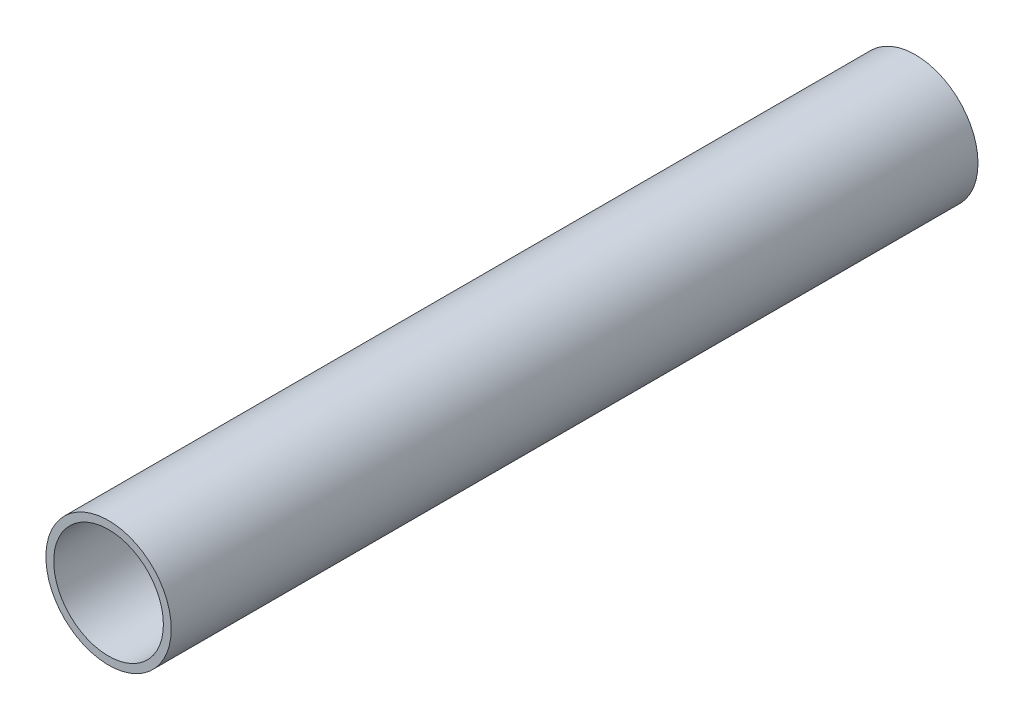
from build123d import *

# Parameters (mm, degrees)
SKETCH1_R           = 8
SKETCH1_R_2         = 7
BOSS_EXTRUDE1_DEPTH = 103


with BuildPart() as part:
    # Sketch1 → Boss-Extrude1 (new body)
    with BuildSketch(Plane.XY):
        Circle(SKETCH1_R)
        Circle(SKETCH1_R_2, mode=Mode.SUBTRACT)
    extrude(amount=BOSS_EXTRUDE1_DEPTH)


solid = part.part
